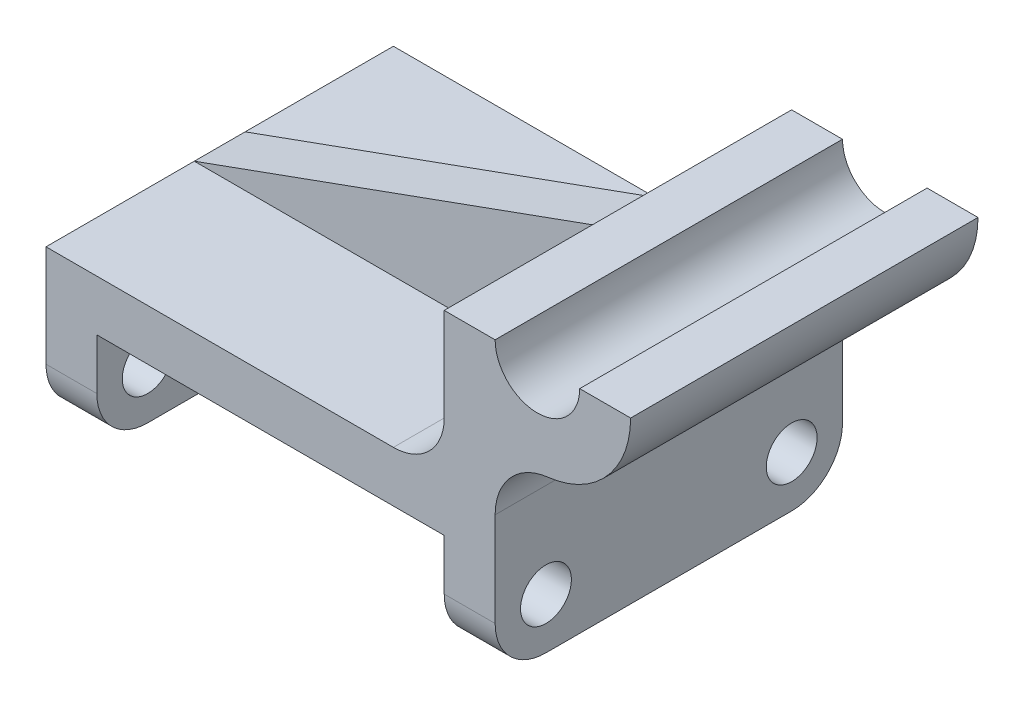
from build123d import *

# Parameters (mm, degrees)
Y_KSEKLIK_EKSTR_ZYON1_DEPTH      = 82
RADYUS1_R                        = 12
IZIM5_R                          = 6
KES_EKSTR_ZYON3_DEPTH            = 107
Y_KSEKLIK_EKSTR_ZYON2_DEPTH      = 6
Y_KSEKLIK_EKSTR_ZYON2_DEPTH_BACK = 6


with BuildPart() as part:
    # Çizim1 → Yükseklik-Ekstrüzyon1 (new body)
    with BuildSketch(Plane.XY):
        with BuildLine():
            Line((-78.213413995, -40.838458766), (-66.213413995, -40.838458766))
            Line((-66.213413995, -40.838458766), (-66.213413995, -16.838458766))
            Line((-66.213413995, -16.838458766), (15.786586005, -16.838458766))
            Line((15.786586005, -16.838458766), (15.786586005, -40.838458766))
            Line((15.786586005, -40.838458766), (27.804920328, -40.838458766))
            Line((27.804920328, -40.838458766), (27.804920328, -6.613491809))
            ThreePointArc((27.804920328, -6.613491809), (31.367545227, 2.717167386), (40.242234758, 7.299021041))
            ThreePointArc((40.242234758, 7.299021041), (54.188175449, 14.499076785), (59.786586005, 29.161541234))
            Line((59.786586005, 29.161541234), (47.768251683, 29.161541234))
            ThreePointArc((47.768251683, 29.161541234), (37.786586005, 19.179875557), (27.804920328, 29.161541234))
            Line((27.804920328, 29.161541234), (15.786586005, 29.161541234))
            Line((15.786586005, 29.161541234), (15.786586005, 7.161541234))
            ThreePointArc((15.786586005, 7.161541234), (12.271867379, -1.32374014), (3.786586005, -4.838458766))
            Line((3.786586005, -4.838458766), (-78.213413995, -4.838458766))
            Line((-78.213413995, -4.838458766), (-78.213413995, -40.838458766))
        make_face()
    extrude(amount=Y_KSEKLIK_EKSTR_ZYON1_DEPTH)

    # Radyus1
    radyus1_edges = [part.edges().sort_by_distance(p)[0] for p in [
        (21.795753166, -40.838458766, 0),
        (-72.213413995, -40.838458766, 0),
        (21.795753166, -40.838458766, 82),
        (-72.213413995, -40.838458766, 82),
    ]]
    fillet(radyus1_edges, radius=RADYUS1_R)

    # Çizim5 → Kes-Ekstrüzyon3 (cut)
    with BuildSketch(Plane.ZY.offset(78.213413995)):
        with Locations((12, -28.838458766)):
            Circle(IZIM5_R)
        with Locations((70, -28.838458766)):
            Circle(IZIM5_R)
    extrude(amount=-KES_EKSTR_ZYON3_DEPTH, mode=Mode.SUBTRACT)

    # Çizim8 → Yükseklik-Ekstrüzyon2 (add, two sides: drawn at the far end of the back side and taken through both)
    with BuildSketch(Plane.XY.offset(41).offset(-Y_KSEKLIK_EKSTR_ZYON2_DEPTH_BACK)):
        with BuildLine():
            Line((15.786586005, 29.161541234), (-78.213413995, -4.838458766))
            Line((-78.213413995, -4.838458766), (3.786586005, -4.838458766))
            ThreePointArc((3.786586005, -4.838458766), (12.271867379, -1.32374014), (15.786586005, 7.161541234))
            Line((15.786586005, 7.161541234), (15.786586005, 29.161541234))
        make_face()
    extrude(amount=Y_KSEKLIK_EKSTR_ZYON2_DEPTH + Y_KSEKLIK_EKSTR_ZYON2_DEPTH_BACK)


solid = part.part
